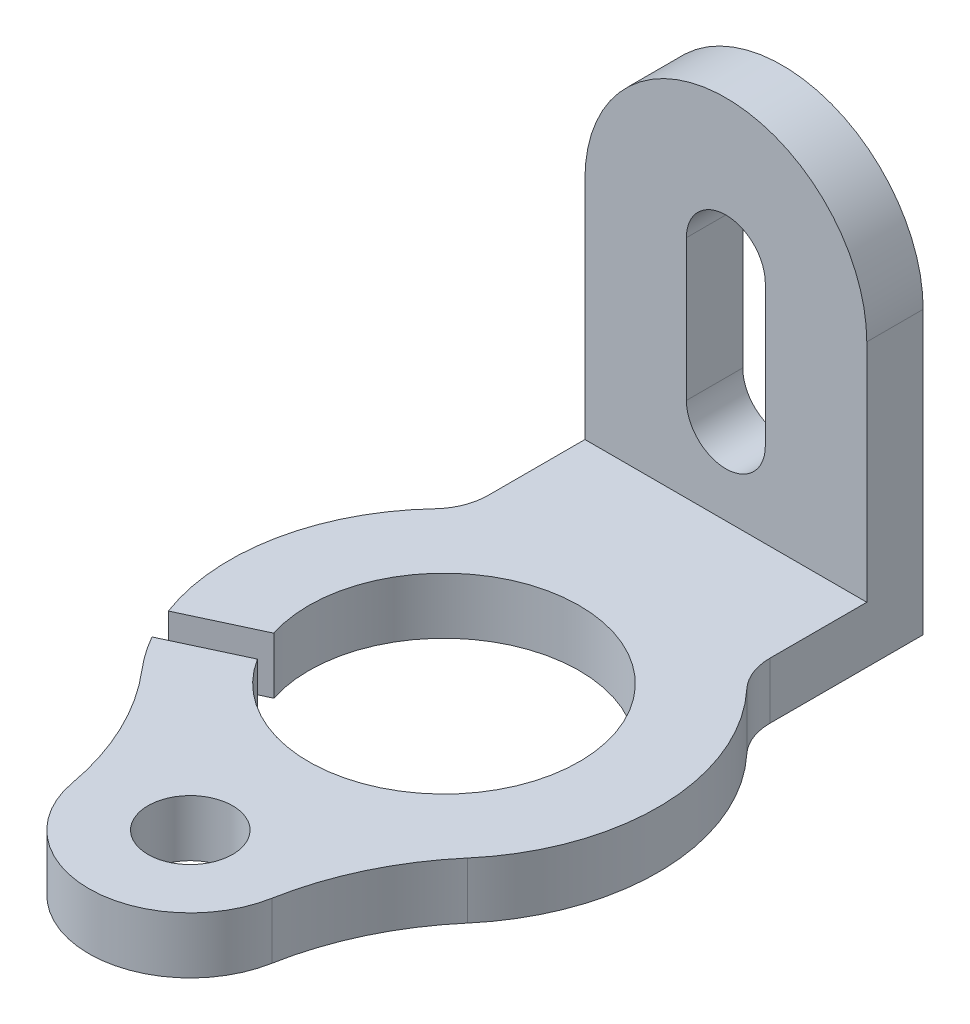
from build123d import *

# Parameters (mm, degrees)
SKETCH1_R           = 7.5
BOSS_EXTRUDE1_DEPTH = 10
SKETCH1_3_W         = 50
SKETCH1_3_H         = 10
BOSS_EXTRUDE2_DEPTH = 75
CUT_EXTRUDE1_REACH  = 142.847


with BuildPart() as part:
    # Sketch1 → Boss-Extrude1 (new body)
    with BuildSketch(Plane(origin=(0, 0, 0), x_dir=(1, 0, 0), z_dir=(0, 1, 0))):
        with BuildLine():
            Line((25, 0), (-25, 0))
            Line((-25, 0), (-25, -17.151864589))
            ThreePointArc((-25, -17.151864589), (-25.701702665, -20.83176495), (-27.708333333, -23.995226133))
            ThreePointArc((-27.708333333, -23.995226133), (-37.256095308, -42.517796957), (-35.600057015, -63.29044546))
            Line((-35.600057015, -63.29044546), (-22.848639927, -57.34436202))
            ThreePointArc((-22.848639927, -57.34436202), (21.751386889, -39.857161718), (-20.312930357, -62.782208742))
            Line((-20.312930357, -62.782208742), (-33.064347445, -68.728292182))
            ThreePointArc((-33.064347445, -68.728292182), (-31.119955968, -71.807070885), (-28.889805354, -74.685606061))
            ThreePointArc((-28.889805354, -74.685606061), (-21.739686255, -85.712027428), (-17.709540124, -98.220588235))
            ThreePointArc((-17.709540124, -98.220588235), (0, -113), (17.709540124, -98.220588235))
            ThreePointArc((17.709540124, -98.220588235), (21.739686255, -85.712027428), (28.889805354, -74.685606061))
            ThreePointArc((28.889805354, -74.685606061), (37.989682547, -49.114550984), (27.708333333, -23.995226133))
            ThreePointArc((27.708333333, -23.995226133), (25.701702665, -20.83176495), (25, -17.151864589))
            Line((25, -17.151864589), (25, 0))
        make_face()
        with Locations((0, -95)):
            Circle(SKETCH1_R, mode=Mode.SUBTRACT)
    extrude(amount=BOSS_EXTRUDE1_DEPTH)

    # Sketch1<3> → Boss-Extrude2 (add)
    with BuildSketch(Plane(origin=(0, 0, 0), x_dir=(1, 0, 0), z_dir=(0, 1, 0))):
        with Locations((0, 5)):
            Rectangle(SKETCH1_3_W, SKETCH1_3_H)
    extrude(amount=BOSS_EXTRUDE2_DEPTH)

    # Sketch2 → Cut-Extrude1 (cut, up to next)
    with BuildSketch(Plane.XY, mode=Mode.PRIVATE) as cut_extrude1_sk1:
        with BuildLine():
            Line((7, 25), (7, 50))
            ThreePointArc((7, 50), (0, 57), (-7, 50))
            Line((-7, 50), (-7, 25))
            ThreePointArc((-7, 25), (0, 18), (7, 25))
        make_face()
    cut_extrude1_tool1 = extrude(cut_extrude1_sk1.sketch, amount=-CUT_EXTRUDE1_REACH, mode=Mode.PRIVATE) & part.part
    # Sketch2 → Cut-Extrude1 (cut, up to next)
    with BuildSketch(Plane.XY, mode=Mode.PRIVATE) as cut_extrude1_sk2:
        with BuildLine():
            ThreePointArc((-25, 50), (-17.67766952, 67.677669539), (2.6e-08, 75))
            Line((2.6e-08, 75), (-25, 75))
            Line((-25, 75), (-25, 50))
        make_face()
    cut_extrude1_tool2 = extrude(cut_extrude1_sk2.sketch, amount=-CUT_EXTRUDE1_REACH, mode=Mode.PRIVATE) & part.part
    # Sketch2 → Cut-Extrude1 (cut, up to next)
    with BuildSketch(Plane.XY, mode=Mode.PRIVATE) as cut_extrude1_sk3:
        with BuildLine():
            ThreePointArc((2.6e-08, 75), (17.677669539, 67.67766952), (25, 50))
            Line((25, 50), (25, 75))
            Line((25, 75), (2.6e-08, 75))
        make_face()
    cut_extrude1_tool3 = extrude(cut_extrude1_sk3.sketch, amount=-CUT_EXTRUDE1_REACH, mode=Mode.PRIVATE) & part.part
    add(cut_extrude1_tool1.solids().sort_by_distance((0, 37.5, 0))[0], mode=Mode.SUBTRACT)
    add(cut_extrude1_tool2.solids().sort_by_distance((-19.415802, 69.415802, 0))[0], mode=Mode.SUBTRACT)
    add(cut_extrude1_tool3.solids().sort_by_distance((19.415802, 69.415802, 0))[0], mode=Mode.SUBTRACT)


solid = part.part
